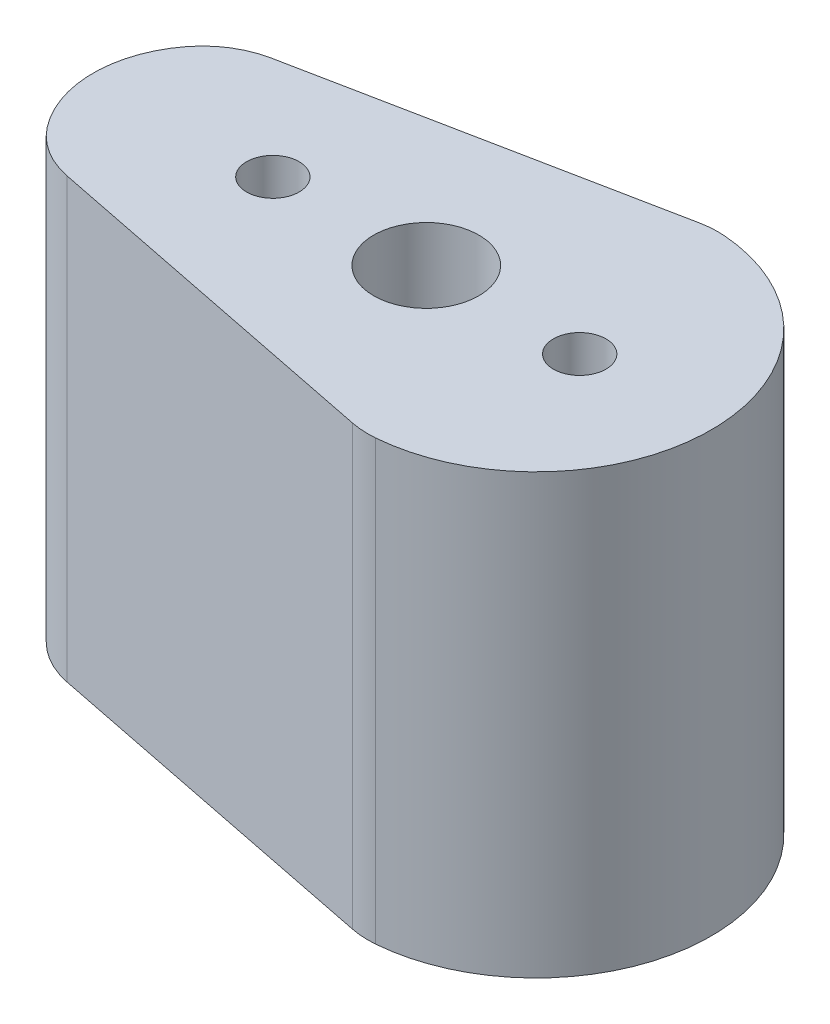
from build123d import *

# Parameters (mm, degrees)
SKETCH1_R           = 0.3
SKETCH1_R_2         = 0.6
BOSS_EXTRUDE1_DEPTH = 5


with BuildPart() as part:
    # Sketch1 → Boss-Extrude1 (new body)
    with BuildSketch(Plane(origin=(0, 0, 0), x_dir=(1, 0, 0), z_dir=(0, 1, 0))):
        with BuildLine():
            ThreePointArc((0.1641009, 1.993256355), (0.024548565, 1.994973575), (-0.113883759, 1.977245221))
            Line((-0.113883759, 1.977245221), (-1.25, 1.750241174))
            Line((-1.25, 1.750241174), (-4.183235691, 1.164159973))
            ThreePointArc((-4.183235691, 1.164159973), (-4.514100231, 1.033532975), (-4.77830642, 0.795352694))
            ThreePointArc((-4.77830642, 0.795352694), (-5.05, 0), (-4.77830642, -0.795352694))
            ThreePointArc((-4.77830642, -0.795352694), (-4.514100231, -1.033532975), (-4.183235691, -1.164159973))
            Line((-4.183235691, -1.164159973), (-1.25, -1.750241174))
            Line((-1.25, -1.750241174), (-0.11388376, -1.977245221))
            ThreePointArc((-0.11388376, -1.977245221), (0.024548564, -1.994973575), (0.164100898, -1.993256355))
            ThreePointArc((0.164100898, -1.993256355), (2, -1e-09), (0.1641009, 1.993256355))
        make_face()
        with Locations(Location((-3, 0, 0), (0, 0, 270))):
            Circle(SKETCH1_R, mode=Mode.SUBTRACT)
        with Locations(Location((-1.25, 0, 0), (0, 0, 270))):
            Circle(SKETCH1_R_2, mode=Mode.SUBTRACT)
        with Locations(Location((0.5, 0, 0), (0, 0, 270))):
            Circle(SKETCH1_R, mode=Mode.SUBTRACT)
    extrude(amount=BOSS_EXTRUDE1_DEPTH)


solid = part.part
